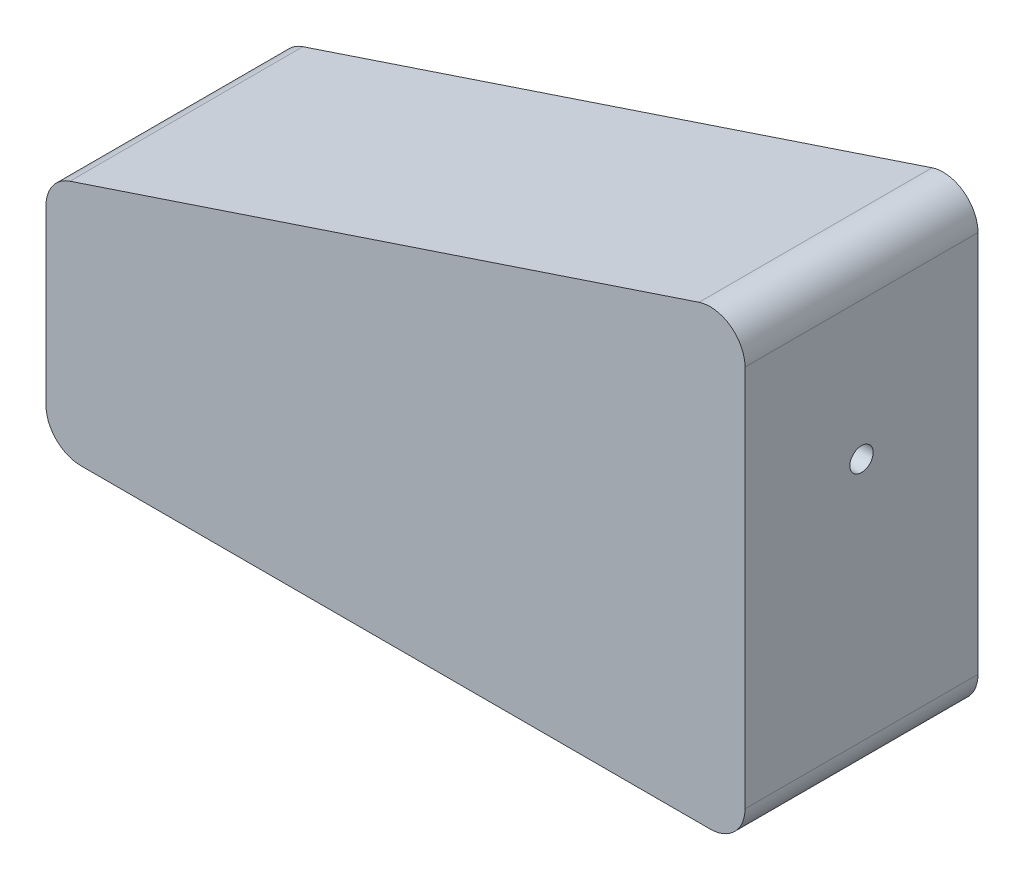
from build123d import *

# Parameters (mm, degrees)
BOSS_EXTRU_1_DEPTH      = 20
CONG_1_R                = 3
ESQUISSE2_R             = 1
ENL_V_MAT_EXTRU_1_DEPTH = 10


with BuildPart() as part:
    # Esquisse1 → Boss.-Extru.1 (new body)
    with BuildSketch(Plane.XY):
        Polygon((0, 0), (60, 0), (60, 40), (0, 20), align=None)
    extrude(amount=BOSS_EXTRU_1_DEPTH)

    # Congé1
    cong_1_edges = [part.edges().sort_by_distance(p)[0] for p in [
        (0, 20, 10),
        (60, 40, 10),
        (60, 0, 10),
        (0, 0, 10),
    ]]
    fillet(cong_1_edges, radius=CONG_1_R)

    # Esquisse2 → Enlèv. mat.-Extru.1 (cut)
    with BuildSketch(Plane(origin=(60, 0, 0), x_dir=(0, 0, -1), z_dir=(1, 0, 0))):
        with Locations((-10, 24)):
            Circle(ESQUISSE2_R)
    extrude(amount=-ENL_V_MAT_EXTRU_1_DEPTH, mode=Mode.SUBTRACT)


solid = part.part
